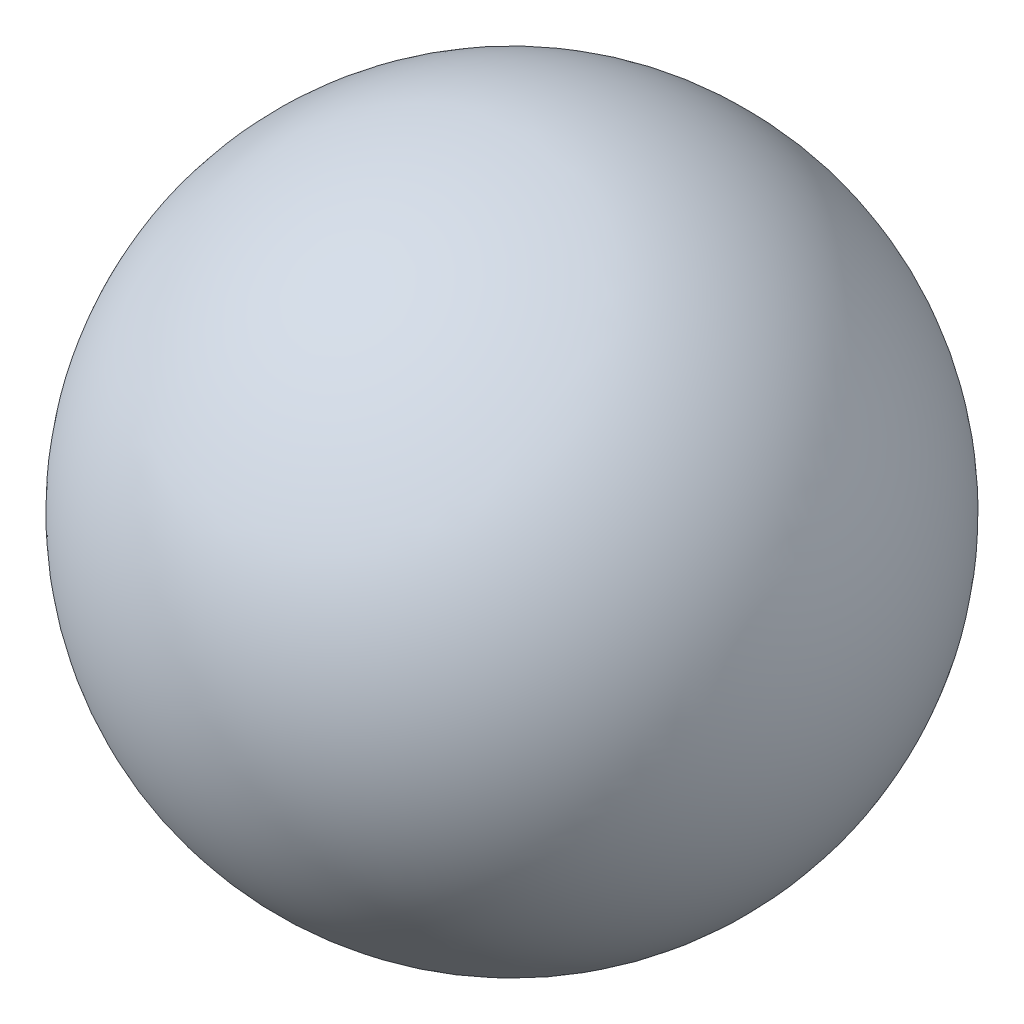
from build123d import *


with BuildPart() as part:
    # Sketch2 → Revolve1 (revolve)
    with BuildSketch(Plane.XY):
        with BuildLine():
            Line((0, 0), (11, 0))
            ThreePointArc((11, 0), (5.5, 5.5), (0, 0))
        make_face()
    revolve(axis=Axis((0, 0, 0), (1, 0, 0)))


solid = part.part
